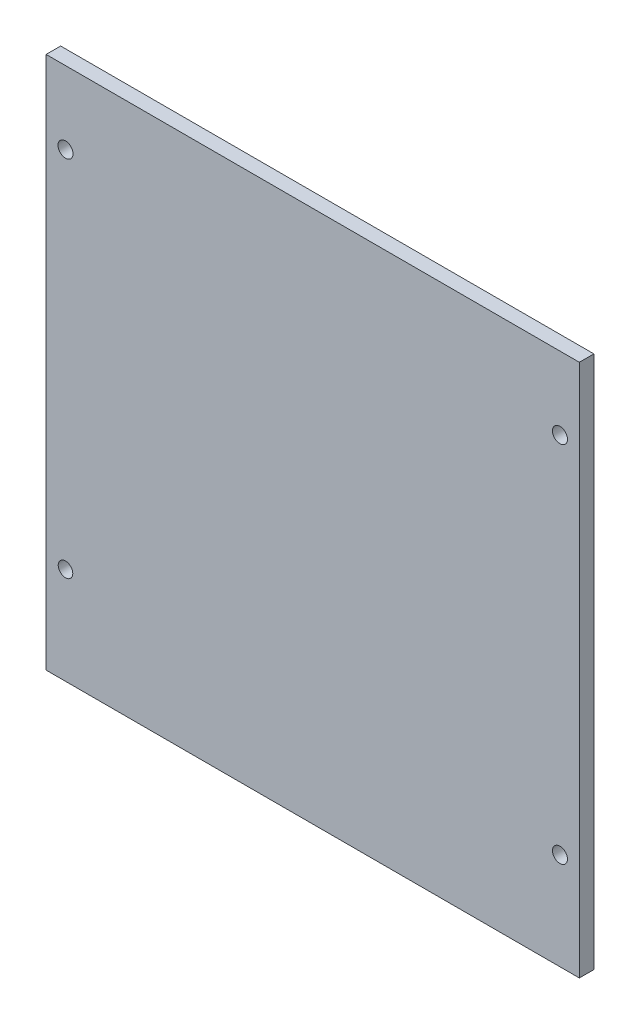
from build123d import *

# Parameters (mm, degrees)
SKETCH_1_W          = 110
SKETCH_1_H          = 110
EXTRUDE_1_DEPTH     = 3
SKETCH_2_R          = 1.55
SKETCH_2_R_2        = 1.5
CUT_EXTRUDE_1_DEPTH = 10


with BuildPart() as part:
    # 草图1 → 凸台-拉伸1 (new body)
    with BuildSketch(Plane.XY):
        Rectangle(SKETCH_1_W, SKETCH_1_H)
    extrude(amount=EXTRUDE_1_DEPTH)

    # 草图2 → 切除-拉伸1 (cut)
    with BuildSketch(Plane.XY.offset(3)):
        with Locations((51, 40)):
            Circle(SKETCH_2_R)
        with Locations((51, -35)):
            Circle(SKETCH_2_R)
        with Locations((-51, 40)):
            Circle(SKETCH_2_R)
        with Locations((-51, -35)):
            Circle(SKETCH_2_R_2)
    extrude(amount=-CUT_EXTRUDE_1_DEPTH, mode=Mode.SUBTRACT)


solid = part.part
